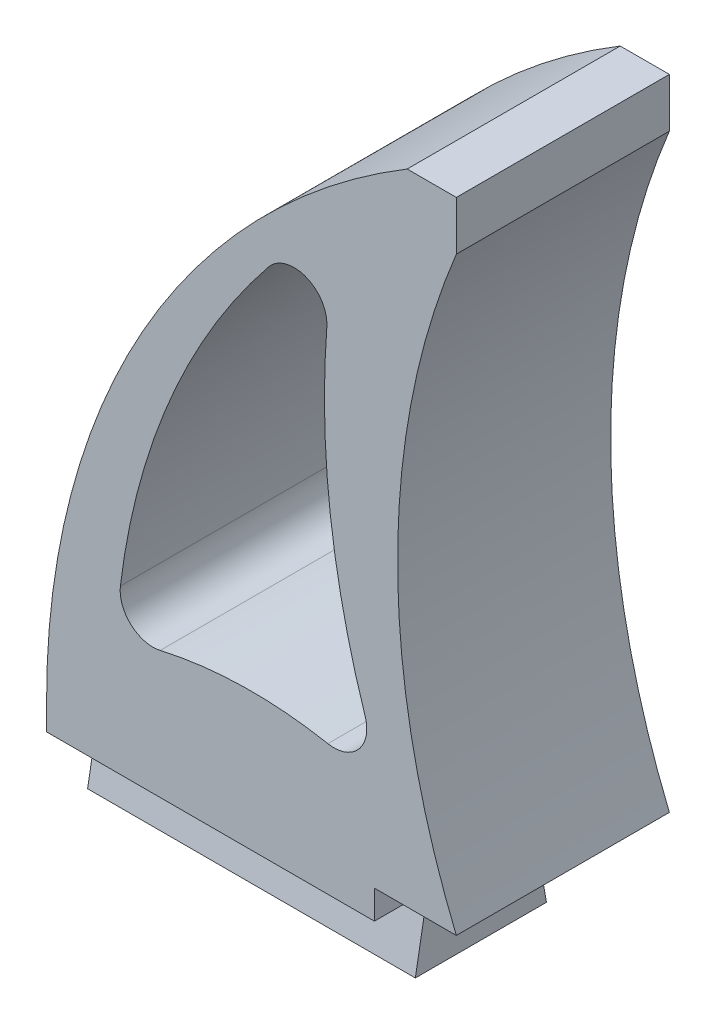
from build123d import *

# Parameters (mm, degrees)
EXTRUDE_1_DEPTH     = 6.5
CUT_EXTRUDE_1_DEPTH = 52.886896226
CUT_EXTRUDE_2_DEPTH = 54.09425581


with BuildPart() as part:
    # 草图1 → 凸台-拉伸1 (new, symmetric)
    with BuildSketch(Plane.XY):
        with BuildLine():
            Line((0, 0), (0, 6))
            ThreePointArc((0, 6), (5.87927664, 28.388613177), (22, 45))
            Line((22, 45), (25, 45))
            Line((25, 45), (25, 42))
            ThreePointArc((25, 42), (21.416586692, 24), (25, 6))
            Line((25, 6), (20, 6))
            Line((20, 6), (20, 0))
            Line((20, 0), (0, 0))
        make_face()
    extrude(amount=EXTRUDE_1_DEPTH, both=True)

    # 草图2 → 切除-拉伸1 (cut, through all)
    with BuildSketch(Plane.ZY):
        Polygon((6.5, 4.253461365), (3.25, 4.253461365), (4, 0), (6.5, 0), align=None)
        Polygon((-4, 0), (-6.5, 0), (-6.5, 4.253461365), (-3.25, 4.253461365), align=None)
    extrude(amount=-CUT_EXTRUDE_1_DEPTH, mode=Mode.SUBTRACT)

    # 草图3 → 切除-拉伸2 (cut, through all)
    with BuildSketch(Plane.XY.offset(6.5)):
        with BuildLine():
            ThreePointArc((6.932463861, 12.026105414), (12.037858369, 12.649666202), (17.162813582, 12.215252555))
            ThreePointArc((17.162813582, 12.215252555), (19.038256161, 12.860028298), (19.436438993, 14.802828097))
            ThreePointArc((19.436438993, 14.802828097), (17.311240055, 24.38211379), (17.097768587, 34.191987125))
            ThreePointArc((17.097768587, 34.191987125), (15.842511021, 36.203388469), (13.548853711, 35.602936079))
            ThreePointArc((13.548853711, 35.602936079), (7.517605312, 25.546939135), (4.501465211, 14.215481563))
            ThreePointArc((4.501465211, 14.215481563), (5.148632601, 12.489739676), (6.932463861, 12.026105414))
        make_face()
    extrude(amount=-CUT_EXTRUDE_2_DEPTH, mode=Mode.SUBTRACT)


solid = part.part
